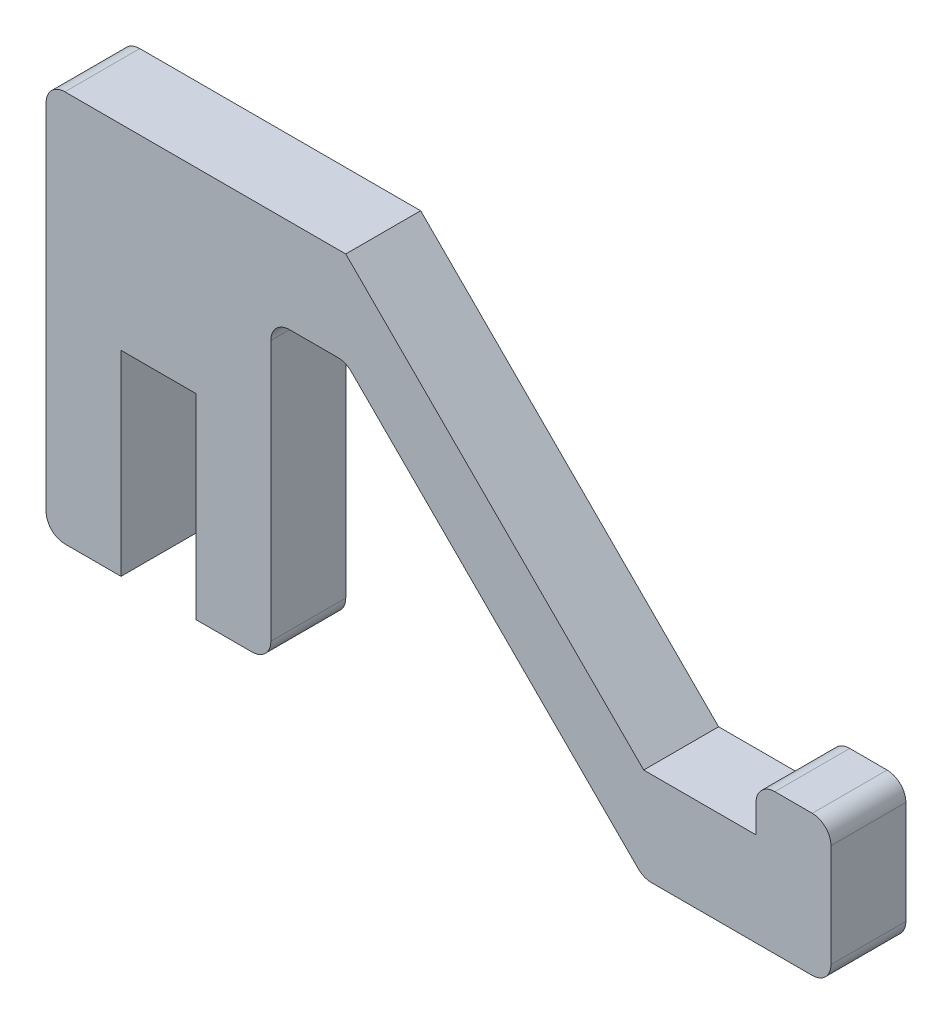
from build123d import *

# Parameters (mm, degrees)
BOSS_EXTRUDE1_DEPTH     = 8
FILLET1_R               = 2
CUT_EXTRUDE1_DEPTH      = 48.514881456
CUT_EXTRUDE1_DEPTH_BACK = 8
SKETCH2_W               = 8
SKETCH2_H               = 20.909902577
CUT_EXTRUDE4_DEPTH      = 1


with BuildPart() as part:
    # Sketch1 → Boss-Extrude1 (new body)
    with BuildSketch(Plane.XY):
        Polygon((-9.909902577, 20.909902577), (21.909902577, -10.909902577), (33.909902577, -10.909902577), (33.909902577, -5.909902577), (41.909902577, -5.909902577), (41.909902577, -20.909902577), (21.909902577, -20.909902577), (-9.909902577, 10.909902577), (-17.909902577, 10.909902577), (-17.909902577, -20.909902577), (-41.909902577, -20.909902577), (-41.909902577, 20.909902577), align=None)
    extrude(amount=BOSS_EXTRUDE1_DEPTH)

    # Fillet1
    fillet1_edges = [part.edges().sort_by_distance(p)[0] for p in [
        (33.909902577, -5.909902577, 4),
        (41.909902577, -5.909902577, 4),
        (41.909902577, -20.909902577, 4),
        (21.909902577, -20.909902577, 4),
        (-9.909902577, 10.909902577, 4),
        (-17.909902577, 10.909902577, 4),
        (-17.909902577, -20.909902577, 4),
        (-41.909902577, -20.909902577, 4),
        (-41.909902577, 20.909902577, 4),
    ]]
    fillet(fillet1_edges, radius=FILLET1_R)

    # Sketch2 → Cut-Extrude1 (cut, two sides: drawn at the far end of the back side and taken through both)
    with BuildSketch(Plane.XY.offset(8).offset(-CUT_EXTRUDE1_DEPTH_BACK)):
        with Locations((-29.909902577, -10.454951289)):
            Rectangle(SKETCH2_W, SKETCH2_H)
    extrude(amount=CUT_EXTRUDE1_DEPTH + CUT_EXTRUDE1_DEPTH_BACK, mode=Mode.SUBTRACT)

    # Sketch4 → Cut-Extrude4 (cut)
    # profile 1 of 8: a face of its own
    with BuildSketch(Plane(origin=(0, 0, 0), x_dir=(-1, 0, 0), z_dir=(0, 0, -1))):
        with BuildLine():
            add(Edge.make_bspline(
                [(-10.505185674, -2.81404301), (-10.472060118, -2.782311922), (-10.406916626, -2.719910738), (-10.300290346, -2.639260568), (-10.190011843, -2.570160554), (-10.075246577, -2.513693897), (-9.95620664, -2.46990326), (-9.833081918, -2.43818906), (-9.705536141, -2.419124274), (-9.575216576, -2.412990965), (-9.445112567, -2.418235002), (-9.317892839, -2.4356685), (-9.195372809, -2.465764732), (-9.07734082, -2.508292597), (-8.963609518, -2.562318787), (-8.855132661, -2.629749473), (-8.750643598, -2.708370751), (-8.686705367, -2.769146111), (-8.654224135, -2.800020574)],
                knots=[0, 0, 0, 0, 1.065182729, 2.094748942, 3.100111911, 4.085511882, 5.061220631, 6.042534805, 7.034972432, 8.052564444, 9.069801487, 10.056734989, 11.031448475, 11.995887646, 12.967539537, 13.951541231, 14.959363372, 16, 16, 16, 16], degree=3))
            add(Edge.make_bspline(
                [(-8.654224135, -2.800020574), (-8.623508066, -2.832156289), (-8.562965851, -2.895496664), (-8.48474761, -2.999485475), (-8.418397281, -3.107860804), (-8.36372245, -3.220827686), (-8.321489765, -3.338684327), (-8.29143091, -3.461382815), (-8.273460431, -3.588710269), (-8.267608823, -3.718999741), (-8.273653126, -3.84921358), (-8.290655566, -3.976509737), (-8.321246019, -4.098836573), (-8.362714813, -4.216853324), (-8.417124869, -4.329952622), (-8.483972036, -4.4378888), (-8.56139579, -4.542158094), (-8.621959448, -4.605358768), (-8.652721731, -4.637460478)],
                knots=[0, 0, 0, 0, 1.042024399, 2.053858669, 3.0450864, 4.018835193, 4.992363513, 5.976262977, 6.976920371, 8.003915854, 9.030911336, 10.031024622, 11.011122082, 11.983334403, 12.960611838, 13.948500462, 14.957975601, 16, 16, 16, 16], degree=3))
            add(Edge.make_bspline(
                [(-8.652721731, -4.637460478), (-8.685371122, -4.668498905), (-8.749644349, -4.729600806), (-8.854612709, -4.808757644), (-8.963399917, -4.87639229), (-9.077270596, -4.931423454), (-9.195483243, -4.97466562), (-9.318572395, -5.005241365), (-9.445894431, -5.023757289), (-9.576177866, -5.030026699), (-9.706285378, -5.024754529), (-9.833141615, -5.007346424), (-9.954908414, -4.977614614), (-10.071934983, -4.936375818), (-10.184131805, -4.883098563), (-10.291046391, -4.817401412), (-10.393737932, -4.740640228), (-10.456345284, -4.681190666), (-10.48815843, -4.650982112)],
                knots=[0, 0, 0, 0, 1.057111361, 2.081017615, 3.080754773, 4.060785583, 5.045399619, 6.03130031, 7.033593295, 8.061879764, 9.089807534, 10.087113287, 11.063523402, 12.028082354, 12.995957114, 13.974128199, 14.970578474, 16, 16, 16, 16], degree=3))
            add(Edge.make_bspline(
                [(-10.48815843, -4.650982112), (-10.508638618, -4.629703527), (-10.549267323, -4.587490955), (-10.604845945, -4.520106817), (-10.655457466, -4.450225024), (-10.702004567, -4.378211753), (-10.742225761, -4.302673727), (-10.778694074, -4.225197344), (-10.809067249, -4.144495009), (-10.835065889, -4.061961215), (-10.855658771, -3.978009545), (-10.870103364, -3.893642664), (-10.879207629, -3.80933979), (-10.882656356, -3.725196044), (-10.880879156, -3.641345185), (-10.872520895, -3.557733122), (-10.859281019, -3.474166441), (-10.83950096, -3.391306761), (-10.815147947, -3.309790698), (-10.785678648, -3.230585908), (-10.750832773, -3.154311079), (-10.711791206, -3.080405577), (-10.667707635, -3.009228071), (-10.618480904, -2.94098444), (-10.564287031, -2.875683043), (-10.524971041, -2.83467825), (-10.505185674, -2.81404301)],
                knots=[0, 0, 0, 0, 1.040069648, 2.063295695, 3.073683405, 4.078545796, 5.081013625, 6.086030863, 7.092973095, 8.11591184, 9.132832499, 10.135369316, 11.128949704, 12.117732983, 13.100060207, 14.080749146, 15.075546923, 16.078290676, 17.079187738, 18.070974109, 19.052597029, 20.031185668, 21.013565695, 21.999319192, 22.993177973, 24, 24, 24, 24], degree=3))
        make_face()
        with BuildLine():
            add(Edge.make_bspline(
                [(-10.325398013, -2.976803426), (-10.341203977, -2.993079954), (-10.372730002, -3.02554455), (-10.414837779, -3.07852864), (-10.454312228, -3.133024481), (-10.48941443, -3.190555489), (-10.521057934, -3.250527905), (-10.548343249, -3.313295344), (-10.57281981, -3.378159539), (-10.592357831, -3.445390945), (-10.608732619, -3.513661805), (-10.619319746, -3.582370879), (-10.6268215, -3.650703593), (-10.62857798, -3.719004533), (-10.626157663, -3.787090844), (-10.619067858, -3.855011043), (-10.607560913, -3.922601939), (-10.591534236, -3.989695413), (-10.571060094, -4.055823126), (-10.545925292, -4.120318641), (-10.516945366, -4.183204428), (-10.483115246, -4.244008391), (-10.445108212, -4.303042071), (-10.402714306, -4.360201092), (-10.356881126, -4.416164311), (-10.322986714, -4.451063158), (-10.305866763, -4.468690446)],
                knots=[0, 0, 0, 0, 0.983693977, 1.962041752, 2.932720314, 3.901532991, 4.883065265, 5.872076546, 6.868879077, 7.888569699, 8.907437036, 9.912309701, 10.902433988, 11.887779398, 12.873364303, 13.856284884, 14.848049896, 15.845772775, 16.846775704, 17.848721296, 18.846680699, 19.848338349, 20.864809226, 21.890321058, 22.934408426, 24, 24, 24, 24], degree=3))
            add(Edge.make_bspline(
                [(-10.305866763, -4.468690446), (-10.279816083, -4.493631301), (-10.228518764, -4.542743223), (-10.144100405, -4.605664691), (-10.056865037, -4.659830432), (-9.965461318, -4.703613071), (-9.870548945, -4.737921342), (-9.77162032, -4.761895158), (-9.669153158, -4.776537798), (-9.564165403, -4.780680704), (-9.459385509, -4.775943196), (-9.357079128, -4.761373519), (-9.258675529, -4.737490192), (-9.164292033, -4.703512225), (-9.073806827, -4.6605568), (-8.987915468, -4.607128678), (-8.904837098, -4.545783914), (-8.8545481, -4.497648208), (-8.829003783, -4.473197657)],
                knots=[0, 0, 0, 0, 1.051851097, 2.071237303, 3.066581889, 4.045146254, 5.023892582, 6.007177031, 7.01121454, 8.040302395, 9.069609416, 10.0688229, 11.052107348, 12.020034829, 12.992099136, 13.969886748, 14.968803156, 16, 16, 16, 16], degree=3))
            add(Edge.make_bspline(
                [(-8.829003783, -4.473197657), (-8.812620956, -4.456011426), (-8.78004309, -4.421835961), (-8.734902501, -4.367868359), (-8.694397771, -4.311335259), (-8.6569051, -4.253379435), (-8.624557077, -4.19254306), (-8.595893949, -4.129849383), (-8.571311931, -4.065100169), (-8.550892347, -3.998491009), (-8.534300149, -3.930994078), (-8.522821415, -3.863017974), (-8.515791094, -3.795273064), (-8.513110632, -3.727505124), (-8.51576682, -3.659899788), (-8.522835721, -3.592493032), (-8.534225858, -3.525161066), (-8.550994697, -3.458376731), (-8.571312312, -3.392181021), (-8.596284899, -3.327758715), (-8.625810289, -3.265245094), (-8.658418776, -3.204141391), (-8.696446697, -3.145292455), (-8.738497935, -3.088326353), (-8.784523435, -3.032995055), (-8.818093456, -2.998297884), (-8.835013398, -2.980809837)],
                knots=[0, 0, 0, 0, 1.026853309, 2.041936333, 3.039952698, 4.033440158, 5.025194378, 6.017158849, 7.013528343, 8.018442471, 9.028918301, 10.017724312, 10.997712279, 11.973141084, 12.948569889, 13.921376208, 14.903065083, 15.899513062, 16.897529427, 17.896485643, 18.884922509, 19.886458766, 20.889919205, 21.912371349, 22.947794663, 24, 24, 24, 24], degree=3))
            add(Edge.make_bspline(
                [(-8.835013398, -2.980809837), (-8.852507093, -2.963899027), (-8.887046376, -2.930510583), (-8.941842255, -2.884696892), (-8.998823506, -2.843886516), (-9.05666159, -2.805590224), (-9.117489028, -2.773678213), (-9.179222679, -2.744548325), (-9.243144749, -2.720693057), (-9.308494904, -2.700603569), (-9.374952125, -2.685199554), (-9.441854058, -2.674046607), (-9.509114404, -2.667604031), (-9.576891209, -2.665360885), (-9.645110783, -2.668814061), (-9.713770855, -2.675417657), (-9.782632251, -2.687777882), (-9.85133138, -2.704240066), (-9.919158616, -2.724523627), (-9.984679179, -2.74909657), (-10.047760948, -2.777313605), (-10.108411133, -2.809291108), (-10.16648304, -2.845502928), (-10.222308527, -2.885132274), (-10.275661049, -2.928676752), (-10.30875796, -2.960702113), (-10.325398013, -2.976803426)],
                knots=[0, 0, 0, 0, 1.05619574, 2.085336687, 3.097259518, 4.098431343, 5.093946709, 6.076502403, 7.06052725, 8.053268447, 9.043068497, 10.020128795, 10.995897894, 11.974784474, 12.961448284, 13.959572234, 14.967646249, 15.996046798, 17.025570501, 18.039282718, 19.032023915, 20.024129928, 21.01366458, 22.001126683, 22.995031332, 24, 24, 24, 24], degree=3))
        make_face(mode=Mode.SUBTRACT)
    # profile 2 of 8: a face of its own
    with BuildSketch(Plane(origin=(0, 0, 0), x_dir=(-1, 0, 0), z_dir=(0, 0, -1))):
        with BuildLine():
            Line((-9.165565083, -1.562563445), (-8.817007391, -1.214005752))
            add(Edge.make_bspline(
                [(-8.817007391, -1.214005752), (-8.793083997, -1.190016361), (-8.747315537, -1.144121637), (-8.679885641, -1.080177602), (-8.61833411, -1.022346833), (-8.562081562, -0.971385734), (-8.510940254, -0.927455128), (-8.464729423, -0.89108378), (-8.424496262, -0.860397826), (-8.398280591, -0.843920327), (-8.386318288, -0.836401586)],
                knots=[0, 0, 0, 0, 1.416971474, 2.710844673, 3.886550687, 4.949426937, 5.885482996, 6.705496379, 7.409313452, 8, 8, 8, 8], degree=3))
            add(Edge.make_bspline(
                [(-8.386318288, -0.836401586), (-8.370751306, -0.827485912), (-8.340012892, -0.809881106), (-8.292109574, -0.787780878), (-8.243533737, -0.769775381), (-8.194375435, -0.755579518), (-8.144430107, -0.745901415), (-8.093621922, -0.741262581), (-8.042072969, -0.739416931), (-7.989964069, -0.742572147), (-7.938147611, -0.749897436), (-7.88711111, -0.762227916), (-7.836862465, -0.778377867), (-7.788313743, -0.800809574), (-7.740976378, -0.827536081), (-7.694689688, -0.858752872), (-7.649400941, -0.894869167), (-7.621049132, -0.922136441), (-7.606570692, -0.936061041)],
                knots=[0, 0, 0, 0, 1.009793068, 1.993927822, 2.966502183, 3.924568233, 4.872155193, 5.826200883, 6.794815104, 7.774044344, 8.761763975, 9.737603538, 10.727467863, 11.728692967, 12.743069578, 13.785922889, 14.869335568, 16, 16, 16, 16], degree=3))
            add(Edge.make_bspline(
                [(-7.606570692, -0.936061041), (-7.592667782, -0.950558788), (-7.565370471, -0.979024017), (-7.528688189, -1.024385565), (-7.496589733, -1.070603408), (-7.46988463, -1.118186223), (-7.447727822, -1.166407226), (-7.430007373, -1.215595136), (-7.417401098, -1.265925455), (-7.410038489, -1.317112872), (-7.406990855, -1.36855277), (-7.408540236, -1.420163962), (-7.414521359, -1.471613148), (-7.425117478, -1.522874293), (-7.440259182, -1.574017209), (-7.460482892, -1.624725391), (-7.484441411, -1.675760307), (-7.503645003, -1.708603313), (-7.513421653, -1.725323861)],
                knots=[0, 0, 0, 0, 1.113350584, 2.185979568, 3.230934622, 4.229778098, 5.207249526, 6.170461489, 7.124557677, 8.078833442, 9.03382718, 9.978356895, 10.938182904, 11.902106184, 12.877339979, 13.8914631, 14.926532666, 16, 16, 16, 16], degree=3))
            add(Edge.make_bspline(
                [(-7.513421653, -1.725323861), (-7.522163254, -1.738583845), (-7.541288793, -1.767595047), (-7.574839886, -1.81305453), (-7.616443999, -1.86344163), (-7.664323958, -1.920349739), (-7.720645993, -1.981976798), (-7.783711962, -2.049784396), (-7.854387029, -2.122699243), (-7.904163154, -2.172923372), (-7.93008832, -2.199081874)],
                knots=[0, 0, 0, 0, 0.603121487, 1.319555111, 2.144347889, 3.084382289, 4.143729233, 5.31447897, 6.601285651, 8, 8, 8, 8], degree=3))
            Line((-7.93008832, -2.199081874), (-8.054787839, -2.323781393))
            Line((-8.054787839, -2.323781393), (-7.240985756, -3.137583477))
            Line((-7.240985756, -3.137583477), (-7.415765403, -3.312363124))
            Line((-7.415765403, -3.312363124), (-9.165565083, -1.562563445))
        make_face()
        with BuildLine():
            Line((-8.820513, -1.558056233), (-8.226061878, -2.152507355))
            Line((-8.226061878, -2.152507355), (-7.92608191, -1.860540208))
            add(Edge.make_bspline(
                [(-7.92608191, -1.860540208), (-7.911598248, -1.845970011), (-7.883701263, -1.817906351), (-7.845428547, -1.775414045), (-7.809808277, -1.736259518), (-7.77953348, -1.697821425), (-7.7521796, -1.662184958), (-7.72981124, -1.627998543), (-7.710768511, -1.596318718), (-7.69167212, -1.556604284), (-7.6744238, -1.50767095), (-7.663026389, -1.448059506), (-7.661601063, -1.38785702), (-7.669683624, -1.327728319), (-7.686833192, -1.269508913), (-7.711459307, -1.213853599), (-7.745280962, -1.162501437), (-7.77323158, -1.132178055), (-7.787359955, -1.116850304)],
                knots=[0, 0, 0, 0, 1.142944814, 2.201426384, 3.181874036, 4.087096959, 4.923094179, 5.680520669, 6.359179662, 6.978196854, 8.129790493, 9.235632842, 10.341358147, 11.465885573, 12.597640581, 13.707727124, 14.84131037, 16, 16, 16, 16], degree=3))
            add(Edge.make_bspline(
                [(-7.787359955, -1.116850304), (-7.802317292, -1.102990126), (-7.831840432, -1.075632586), (-7.882902485, -1.043612124), (-7.937495892, -1.018477743), (-7.995736313, -1.002531069), (-8.05495406, -0.993712435), (-8.113845694, -0.993935848), (-8.171066581, -1.004394056), (-8.217804339, -1.020086446), (-8.254842458, -1.0391515), (-8.285607243, -1.056495191), (-8.317962052, -1.078818701), (-8.352582109, -1.105043987), (-8.389556801, -1.135038574), (-8.428751605, -1.169164217), (-8.46950547, -1.207761842), (-8.497207454, -1.234993607), (-8.511518609, -1.249061842)],
                knots=[0, 0, 0, 0, 1.162901255, 2.295361425, 3.426575654, 4.586107877, 5.732699896, 6.839194033, 7.933783815, 9.043848952, 9.641046512, 10.311860402, 11.060547925, 11.884666868, 12.793370438, 13.780397755, 14.853328635, 16, 16, 16, 16], degree=3))
            Line((-8.511518609, -1.249061842), (-8.820513, -1.558056233))
        make_face(mode=Mode.SUBTRACT)
    # profile 3 of 8: a face of its own
    with BuildSketch(Plane(origin=(0, 0, 0), x_dir=(-1, 0, 0), z_dir=(0, 0, -1))):
        with BuildLine():
            Line((-7.715089634, -0.112087996), (-7.366531942, 0.236469696))
            add(Edge.make_bspline(
                [(-7.366531942, 0.236469696), (-7.342608549, 0.260459088), (-7.296840088, 0.306353811), (-7.229410193, 0.370297846), (-7.167858662, 0.428128615), (-7.111606113, 0.479089714), (-7.060464806, 0.523020321), (-7.014253975, 0.559391669), (-6.974020813, 0.590077622), (-6.947805142, 0.606555122), (-6.935842839, 0.614073863)],
                knots=[0, 0, 0, 0, 1.416971474, 2.710844673, 3.886550687, 4.949426937, 5.885482996, 6.705496379, 7.409313452, 8, 8, 8, 8], degree=3))
            add(Edge.make_bspline(
                [(-6.935842839, 0.614073863), (-6.920275858, 0.622989537), (-6.889537444, 0.640594342), (-6.841634125, 0.662694571), (-6.793058289, 0.680700067), (-6.743899986, 0.69489593), (-6.693954658, 0.704574034), (-6.643146474, 0.709212868), (-6.591597521, 0.711058518), (-6.53948862, 0.707903302), (-6.487672163, 0.700578013), (-6.436635661, 0.688247533), (-6.386387017, 0.672097582), (-6.337838294, 0.649665875), (-6.290500929, 0.622939368), (-6.24421424, 0.591722577), (-6.198925492, 0.555606281), (-6.170573683, 0.528339007), (-6.156095243, 0.514414408)],
                knots=[0, 0, 0, 0, 1.009793068, 1.993927822, 2.966502183, 3.924568233, 4.872155193, 5.826200883, 6.794815104, 7.774044344, 8.761763975, 9.737603538, 10.727467863, 11.728692967, 12.743069578, 13.785922889, 14.869335568, 16, 16, 16, 16], degree=3))
            add(Edge.make_bspline(
                [(-6.156095243, 0.514414408), (-6.142192333, 0.499916661), (-6.114895022, 0.471451432), (-6.078212741, 0.426089884), (-6.046114284, 0.379872041), (-6.019409181, 0.332289226), (-5.997252373, 0.284068222), (-5.979531924, 0.234880312), (-5.96692565, 0.184549993), (-5.959563041, 0.133362577), (-5.956515407, 0.081922679), (-5.958064787, 0.030311486), (-5.96404591, -0.021137699), (-5.974642029, -0.072398844), (-5.989783734, -0.12354176), (-6.010007443, -0.174249942), (-6.033965963, -0.225284858), (-6.053169554, -0.258127864), (-6.062946205, -0.274848413)],
                knots=[0, 0, 0, 0, 1.113350584, 2.185979568, 3.230934622, 4.229778098, 5.207249526, 6.170461489, 7.124557677, 8.078833442, 9.03382718, 9.978356895, 10.938182904, 11.902106184, 12.877339979, 13.8914631, 14.926532666, 16, 16, 16, 16], degree=3))
            add(Edge.make_bspline(
                [(-6.062946205, -0.274848413), (-6.071687805, -0.288108396), (-6.090813345, -0.317119598), (-6.124364437, -0.362579081), (-6.165968551, -0.412966181), (-6.213848509, -0.46987429), (-6.270170544, -0.531501349), (-6.333236513, -0.599308948), (-6.403911581, -0.672223795), (-6.453687705, -0.722447923), (-6.479612871, -0.748606426)],
                knots=[0, 0, 0, 0, 0.603121487, 1.319555111, 2.144347889, 3.084382289, 4.143729233, 5.31447897, 6.601285651, 8, 8, 8, 8], degree=3))
            Line((-6.479612871, -0.748606426), (-6.604312391, -0.873305945))
            Line((-6.604312391, -0.873305945), (-5.790510307, -1.687108028))
            Line((-5.790510307, -1.687108028), (-5.965289955, -1.861887676))
            Line((-5.965289955, -1.861887676), (-7.715089634, -0.112087996))
        make_face()
        with BuildLine():
            Line((-7.370037551, -0.107580785), (-6.775586429, -0.702031906))
            Line((-6.775586429, -0.702031906), (-6.475606461, -0.410064759))
            add(Edge.make_bspline(
                [(-6.475606461, -0.410064759), (-6.4611228, -0.395494563), (-6.433225814, -0.367430903), (-6.394953099, -0.324938596), (-6.359332828, -0.285784069), (-6.329058032, -0.247345976), (-6.301704152, -0.21170951), (-6.279335792, -0.177523094), (-6.260293062, -0.145843269), (-6.241196672, -0.106128835), (-6.223948352, -0.057195501), (-6.212550941, 0.002415942), (-6.211125614, 0.062618429), (-6.219208175, 0.12274713), (-6.236357743, 0.180966535), (-6.260983859, 0.23662185), (-6.294805514, 0.287974012), (-6.322756131, 0.318297394), (-6.336884506, 0.333625145)],
                knots=[0, 0, 0, 0, 1.142944814, 2.201426384, 3.181874036, 4.087096959, 4.923094179, 5.680520669, 6.359179662, 6.978196854, 8.129790493, 9.235632842, 10.341358147, 11.465885573, 12.597640581, 13.707727124, 14.84131037, 16, 16, 16, 16], degree=3))
            add(Edge.make_bspline(
                [(-6.336884506, 0.333625145), (-6.351841844, 0.347485323), (-6.381364983, 0.374842863), (-6.432427037, 0.406863325), (-6.487020443, 0.431997705), (-6.545260864, 0.447944379), (-6.604478611, 0.456763014), (-6.663370246, 0.4565396), (-6.720591133, 0.446081392), (-6.76732889, 0.430389002), (-6.804367009, 0.411323948), (-6.835131794, 0.393980258), (-6.867486603, 0.371656748), (-6.902106661, 0.345431461), (-6.939081352, 0.315436874), (-6.978276157, 0.281311232), (-7.019030021, 0.242713606), (-7.046732005, 0.215481841), (-7.06104316, 0.201413606)],
                knots=[0, 0, 0, 0, 1.162901255, 2.295361425, 3.426575654, 4.586107877, 5.732699896, 6.839194033, 7.933783815, 9.043848952, 9.641046512, 10.311860402, 11.060547925, 11.884666868, 12.793370438, 13.780397755, 14.853328635, 16, 16, 16, 16], degree=3))
            Line((-7.06104316, 0.201413606), (-7.370037551, -0.107580785))
        make_face(mode=Mode.SUBTRACT)
    # profile 4 of 8: a face of its own
    with BuildSketch(Plane(origin=(0, 0, 0), x_dir=(-1, 0, 0), z_dir=(0, 0, -1))):
        with BuildLine():
            add(Edge.make_bspline(
                [(-5.473848961, 2.217293702), (-5.440723406, 2.249024791), (-5.375579914, 2.311425974), (-5.268953634, 2.392076144), (-5.15867513, 2.461176158), (-5.043909865, 2.517642815), (-4.924869927, 2.561433453), (-4.801745206, 2.593147652), (-4.674199429, 2.612212438), (-4.543879863, 2.618345747), (-4.413775854, 2.61310171), (-4.286556126, 2.595668212), (-4.164036097, 2.56557198), (-4.046004108, 2.523044116), (-3.932272806, 2.469017926), (-3.823795949, 2.401587239), (-3.719306885, 2.322965961), (-3.655368655, 2.262190602), (-3.622887423, 2.231316138)],
                knots=[0, 0, 0, 0, 1.065182729, 2.094748942, 3.100111911, 4.085511882, 5.061220631, 6.042534805, 7.034972432, 8.052564444, 9.069801487, 10.056734989, 11.031448475, 11.995887646, 12.967539537, 13.951541231, 14.959363372, 16, 16, 16, 16], degree=3))
            add(Edge.make_bspline(
                [(-3.622887423, 2.231316138), (-3.592171353, 2.199180423), (-3.531629138, 2.135840048), (-3.453410898, 2.031851237), (-3.387060569, 1.923475908), (-3.332385738, 1.810509026), (-3.290153052, 1.692652385), (-3.260094197, 1.569953897), (-3.242123718, 1.442626443), (-3.23627211, 1.312336972), (-3.242316414, 1.182123132), (-3.259318853, 1.054826975), (-3.289909307, 0.932500139), (-3.3313781, 0.814483389), (-3.385788157, 0.701384091), (-3.452635324, 0.593447912), (-3.530059078, 0.489178618), (-3.590622736, 0.425977945), (-3.621385019, 0.393876235)],
                knots=[0, 0, 0, 0, 1.042024399, 2.053858669, 3.0450864, 4.018835193, 4.992363513, 5.976262977, 6.976920371, 8.003915854, 9.030911336, 10.031024622, 11.011122082, 11.983334403, 12.960611838, 13.948500462, 14.957975601, 16, 16, 16, 16], degree=3))
            add(Edge.make_bspline(
                [(-3.621385019, 0.393876235), (-3.65403441, 0.362837807), (-3.718307637, 0.301735906), (-3.823275997, 0.222579068), (-3.932063205, 0.154944422), (-4.045933884, 0.099913258), (-4.164146531, 0.056671092), (-4.287235683, 0.026095347), (-4.414557718, 0.007579423), (-4.544841154, 0.001310013), (-4.674948666, 0.006582183), (-4.801804903, 0.023990288), (-4.923571702, 0.053722098), (-5.040598271, 0.094960894), (-5.152795093, 0.148238149), (-5.259709679, 0.2139353), (-5.362401219, 0.290696485), (-5.425008571, 0.350146046), (-5.456821718, 0.3803546)],
                knots=[0, 0, 0, 0, 1.057111361, 2.081017615, 3.080754773, 4.060785583, 5.045399619, 6.03130031, 7.033593295, 8.061879764, 9.089807534, 10.087113287, 11.063523402, 12.028082354, 12.995957114, 13.974128199, 14.970578474, 16, 16, 16, 16], degree=3))
            add(Edge.make_bspline(
                [(-5.456821718, 0.3803546), (-5.477301905, 0.401633186), (-5.517930611, 0.443845757), (-5.573509233, 0.511229895), (-5.624120754, 0.581111688), (-5.670667855, 0.653124959), (-5.710889048, 0.728662985), (-5.747357362, 0.806139369), (-5.777730537, 0.886841704), (-5.803729177, 0.969375498), (-5.824322059, 1.053327167), (-5.838766652, 1.137694048), (-5.847870916, 1.221996922), (-5.851319643, 1.306140669), (-5.849542443, 1.389991528), (-5.841184183, 1.47360359), (-5.827944306, 1.557170271), (-5.808164248, 1.640029951), (-5.783811235, 1.721546014), (-5.754341936, 1.800750804), (-5.71949606, 1.877025634), (-5.680454494, 1.950931135), (-5.636370923, 2.022108642), (-5.587144191, 2.090352272), (-5.532950319, 2.155653669), (-5.493634329, 2.196658462), (-5.473848961, 2.217293702)],
                knots=[0, 0, 0, 0, 1.040069648, 2.063295695, 3.073683405, 4.078545796, 5.081013625, 6.086030863, 7.092973095, 8.11591184, 9.132832499, 10.135369316, 11.128949704, 12.117732983, 13.100060207, 14.080749146, 15.075546923, 16.078290676, 17.079187738, 18.070974109, 19.052597029, 20.031185668, 21.013565695, 21.999319192, 22.993177973, 24, 24, 24, 24], degree=3))
        make_face()
        with BuildLine():
            add(Edge.make_bspline(
                [(-5.294061301, 2.054533286), (-5.309867265, 2.038256758), (-5.341393289, 2.005792163), (-5.383501066, 1.952808072), (-5.422975516, 1.898312231), (-5.458077718, 1.840781223), (-5.489721221, 1.780808807), (-5.517006537, 1.718041368), (-5.541483097, 1.653177173), (-5.561021118, 1.585945768), (-5.577395907, 1.517674907), (-5.587983034, 1.448965834), (-5.595484787, 1.380633119), (-5.597241268, 1.312332179), (-5.594820951, 1.244245868), (-5.587731146, 1.176325669), (-5.576224201, 1.108734774), (-5.560197524, 1.041641299), (-5.539723382, 0.975513586), (-5.51458858, 0.911018071), (-5.485608654, 0.848132285), (-5.451778534, 0.787328321), (-5.4137715, 0.728294641), (-5.371377594, 0.671135621), (-5.325544414, 0.615172402), (-5.291650002, 0.580273554), (-5.274530051, 0.562646267)],
                knots=[0, 0, 0, 0, 0.983693977, 1.962041752, 2.932720314, 3.901532991, 4.883065265, 5.872076546, 6.868879077, 7.888569699, 8.907437036, 9.912309701, 10.902433988, 11.887779398, 12.873364303, 13.856284884, 14.848049896, 15.845772775, 16.846775704, 17.848721296, 18.846680699, 19.848338349, 20.864809226, 21.890321058, 22.934408426, 24, 24, 24, 24], degree=3))
            add(Edge.make_bspline(
                [(-5.274530051, 0.562646267), (-5.248479371, 0.537705411), (-5.197182052, 0.488593489), (-5.112763693, 0.425672021), (-5.025528324, 0.37150628), (-4.934124605, 0.327723641), (-4.839212232, 0.293415371), (-4.740283607, 0.269441554), (-4.637816445, 0.254798915), (-4.532828691, 0.250656008), (-4.428048797, 0.255393516), (-4.325742416, 0.269963194), (-4.227338817, 0.29384652), (-4.13295532, 0.327824488), (-4.042470115, 0.370779913), (-3.956578756, 0.424208034), (-3.873500386, 0.485552798), (-3.823211387, 0.533688504), (-3.79766707, 0.558139055)],
                knots=[0, 0, 0, 0, 1.051851097, 2.071237303, 3.066581889, 4.045146254, 5.023892582, 6.007177031, 7.01121454, 8.040302395, 9.069609416, 10.0688229, 11.052107348, 12.020034829, 12.992099136, 13.969886748, 14.968803156, 16, 16, 16, 16], degree=3))
            add(Edge.make_bspline(
                [(-3.79766707, 0.558139055), (-3.781284243, 0.575325286), (-3.748706378, 0.609500751), (-3.703565788, 0.663468353), (-3.663061059, 0.720001453), (-3.625568387, 0.777957277), (-3.593220364, 0.838793653), (-3.564557237, 0.90148733), (-3.539975219, 0.966236543), (-3.519555634, 1.032845703), (-3.502963437, 1.100342634), (-3.491484702, 1.168318739), (-3.484454382, 1.236063648), (-3.48177392, 1.303831588), (-3.484430108, 1.371436924), (-3.491499008, 1.438843681), (-3.502889146, 1.506175646), (-3.519657985, 1.572959981), (-3.5399756, 1.639155691), (-3.564948187, 1.703577997), (-3.594473576, 1.766091618), (-3.627082064, 1.827195322), (-3.665109985, 1.886044258), (-3.707161223, 1.94301036), (-3.753186723, 1.998341658), (-3.786756744, 2.033038828), (-3.803676686, 2.050526876)],
                knots=[0, 0, 0, 0, 1.026853309, 2.041936333, 3.039952698, 4.033440158, 5.025194378, 6.017158849, 7.013528343, 8.018442471, 9.028918301, 10.017724312, 10.997712279, 11.973141084, 12.948569889, 13.921376208, 14.903065083, 15.899513062, 16.897529427, 17.896485643, 18.884922509, 19.886458766, 20.889919205, 21.912371349, 22.947794663, 24, 24, 24, 24], degree=3))
            add(Edge.make_bspline(
                [(-3.803676686, 2.050526876), (-3.821170381, 2.067437685), (-3.855709664, 2.100826129), (-3.910505543, 2.146639821), (-3.967486794, 2.187450197), (-4.025324878, 2.225746489), (-4.086152316, 2.257658499), (-4.147885967, 2.286788387), (-4.211808037, 2.310643655), (-4.277158192, 2.330733143), (-4.343615413, 2.346137159), (-4.410517346, 2.357290105), (-4.477777691, 2.363732681), (-4.545554497, 2.365975827), (-4.61377407, 2.362522651), (-4.682434143, 2.355919055), (-4.751295538, 2.343558831), (-4.819994668, 2.327096646), (-4.887821904, 2.306813085), (-4.953342466, 2.282240143), (-5.016424236, 2.254023107), (-5.077074421, 2.222045604), (-5.135146328, 2.185833785), (-5.190971815, 2.146204438), (-5.244324336, 2.102659961), (-5.277421248, 2.070634599), (-5.294061301, 2.054533286)],
                knots=[0, 0, 0, 0, 1.05619574, 2.085336687, 3.097259518, 4.098431343, 5.093946709, 6.076502403, 7.06052725, 8.053268447, 9.043068497, 10.020128795, 10.995897894, 11.974784474, 12.961448284, 13.959572234, 14.967646249, 15.996046798, 17.025570501, 18.039282718, 19.032023915, 20.024129928, 21.01366458, 22.001126683, 22.995031332, 24, 24, 24, 24], degree=3))
        make_face(mode=Mode.SUBTRACT)
    # profile 5 of 8: a face of its own
    with BuildSketch(Plane(origin=(0, 0, 0), x_dir=(-1, 0, 0), z_dir=(0, 0, -1))):
        with BuildLine():
            Line((-2.890237986, 1.865207562), (-2.830642633, 2.103088171))
            add(Edge.make_bspline(
                [(-2.830642633, 2.103088171), (-2.794899116, 2.093267245), (-2.726480964, 2.074468603), (-2.625691355, 2.057532396), (-2.532442992, 2.049638921), (-2.446410153, 2.053443422), (-2.367816348, 2.067628425), (-2.296761476, 2.092883146), (-2.232581963, 2.128390996), (-2.196912724, 2.160614258), (-2.179100165, 2.17670596)],
                knots=[0, 0, 0, 0, 1.291176079, 2.471493815, 3.556724466, 4.546898705, 5.46435486, 6.329279941, 7.165673282, 8, 8, 8, 8], degree=3))
            add(Edge.make_bspline(
                [(-2.179100165, 2.17670596), (-2.164973699, 2.191704337), (-2.137080175, 2.221319499), (-2.10300733, 2.271924598), (-2.07460733, 2.32547377), (-2.053846871, 2.382531619), (-2.039949402, 2.44065753), (-2.032682813, 2.498725605), (-2.035722162, 2.555731038), (-2.045434772, 2.611081169), (-2.063324969, 2.663334295), (-2.086309151, 2.712826696), (-2.11634738, 2.757994536), (-2.140838626, 2.784483112), (-2.153058499, 2.79769955)],
                knots=[0, 0, 0, 0, 1.071286647, 2.115317441, 3.165122386, 4.221206662, 5.266973049, 6.273002152, 7.256239962, 8.228114947, 9.190222097, 10.123424534, 11.06368533, 12, 12, 12, 12], degree=3))
            add(Edge.make_bspline(
                [(-2.153058499, 2.79769955), (-2.16827907, 2.811684428), (-2.199085942, 2.839990223), (-2.2549432, 2.871371009), (-2.316715109, 2.896861784), (-2.361341643, 2.90610089), (-2.384428691, 2.910880639)],
                knots=[0, 0, 0, 0, 0.945448006, 1.913613914, 2.920631048, 4, 4, 4, 4], degree=3))
            add(Edge.make_bspline(
                [(-2.384428691, 2.910880639), (-2.40193336, 2.913423031), (-2.438664488, 2.91875789), (-2.49704447, 2.922891655), (-2.561029628, 2.924962577), (-2.63087585, 2.92380801), (-2.706344019, 2.91955974), (-2.787528702, 2.913165089), (-2.874322547, 2.903425853), (-2.933989093, 2.895466918), (-2.964857377, 2.891349389)],
                knots=[0, 0, 0, 0, 0.728237508, 1.528105792, 2.408504073, 3.364194011, 4.403737984, 5.52102854, 6.71751255, 8, 8, 8, 8], degree=3))
            add(Edge.make_bspline(
                [(-2.964857377, 2.891349389), (-2.995565255, 2.887281915), (-3.054271572, 2.879505851), (-3.138378833, 2.869339553), (-3.214346107, 2.86174256), (-3.282317582, 2.856715263), (-3.34226709, 2.853622728), (-3.394202715, 2.852421302), (-3.438245468, 2.853413801), (-3.46467287, 2.856771449), (-3.476676287, 2.858296505)],
                knots=[0, 0, 0, 0, 1.446122065, 2.764648949, 3.95499131, 5.00997518, 5.946344691, 6.75700229, 7.435426173, 8, 8, 8, 8], degree=3))
            add(Edge.make_bspline(
                [(-3.476676287, 2.858296505), (-3.49442827, 2.86118633), (-3.52937234, 2.866874835), (-3.580223391, 2.880173945), (-3.628845462, 2.8965531), (-3.675069975, 2.916674473), (-3.71909882, 2.940274426), (-3.760422171, 2.968122548), (-3.800407277, 2.998369236), (-3.824609618, 3.021480684), (-3.836752409, 3.033076152)],
                knots=[0, 0, 0, 0, 1.058992889, 2.084585255, 3.092151245, 4.078670416, 5.051071046, 6.030210775, 7.011717962, 8, 8, 8, 8], degree=3))
            add(Edge.make_bspline(
                [(-3.836752409, 3.033076152), (-3.854903907, 3.052269827), (-3.890617105, 3.090033515), (-3.933020989, 3.154999576), (-3.967785998, 3.223065797), (-3.991413836, 3.295628409), (-4.006478371, 3.370099083), (-4.009585845, 3.446179556), (-4.003222986, 3.522659444), (-3.985914268, 3.598874811), (-3.959097967, 3.673139637), (-3.922696393, 3.743480877), (-3.878019785, 3.809813112), (-3.841337407, 3.848691376), (-3.822729973, 3.868412691)],
                knots=[0, 0, 0, 0, 1.018756783, 2.00441099, 2.985114787, 3.964120394, 4.943168492, 5.911686244, 6.895629666, 7.900220798, 8.922401846, 9.937784271, 10.953924345, 12, 12, 12, 12], degree=3))
            add(Edge.make_bspline(
                [(-3.822729973, 3.868412691), (-3.801727902, 3.888098273), (-3.760052307, 3.927161486), (-3.688415241, 3.973945254), (-3.612059179, 4.012065659), (-3.543789975, 4.03575654), (-3.485311692, 4.048860708), (-3.437494911, 4.056502898), (-3.385938783, 4.060657894), (-3.330959438, 4.062785094), (-3.272454831, 4.06162175), (-3.210303755, 4.057533683), (-3.144505955, 4.050473547), (-3.099554097, 4.044002099), (-3.076536063, 4.040688332)],
                knots=[0, 0, 0, 0, 1.295389454, 2.570514484, 3.839162407, 5.136037099, 5.815087671, 6.538780224, 7.316766775, 8.145019492, 9.018002452, 9.952992277, 10.951809883, 12, 12, 12, 12], degree=3))
            Line((-3.076536063, 4.040688332), (-3.111091351, 3.789786889))
            add(Edge.make_bspline(
                [(-3.111091351, 3.789786889), (-3.129614388, 3.792166254), (-3.165287337, 3.796748599), (-3.2169917, 3.802695932), (-3.265143673, 3.805356558), (-3.309731388, 3.807226764), (-3.350658388, 3.806499589), (-3.388004291, 3.804990397), (-3.421428185, 3.800312674), (-3.460750812, 3.7924782), (-3.506005308, 3.778053582), (-3.556540562, 3.753774967), (-3.603636734, 3.722603409), (-3.631413974, 3.697034548), (-3.645446319, 3.684117819)],
                knots=[0, 0, 0, 0, 1.184218173, 2.280649553, 3.298770581, 4.241350513, 5.109366531, 5.893783283, 6.609332804, 7.246620599, 8.434994267, 9.609093371, 10.792175694, 12, 12, 12, 12], degree=3))
            add(Edge.make_bspline(
                [(-3.645446319, 3.684117819), (-3.661717619, 3.666495842), (-3.693201382, 3.63239862), (-3.727051514, 3.572988448), (-3.748866111, 3.510901124), (-3.75679673, 3.446696411), (-3.751675226, 3.383593576), (-3.735157849, 3.323584627), (-3.705509197, 3.268104043), (-3.677375232, 3.23686625), (-3.662974364, 3.220876633)],
                knots=[0, 0, 0, 0, 1.108181413, 2.144249075, 3.142172967, 4.13985706, 5.117432795, 6.057641393, 7.00576941, 8, 8, 8, 8], degree=3))
            add(Edge.make_bspline(
                [(-3.662974364, 3.220876633), (-3.653163986, 3.211618193), (-3.633774811, 3.193319868), (-3.60095963, 3.170078999), (-3.566057477, 3.150158267), (-3.528134938, 3.133103549), (-3.485686162, 3.119816183), (-3.437556164, 3.111378601), (-3.38349243, 3.105754555), (-3.345482907, 3.105058093), (-3.3254343, 3.104690736)],
                knots=[0, 0, 0, 0, 0.880441848, 1.740100151, 2.619460374, 3.503206461, 4.451875234, 5.517205648, 6.690418517, 8, 8, 8, 8], degree=3))
            add(Edge.make_bspline(
                [(-3.3254343, 3.104690736), (-3.318419778, 3.104972761), (-3.301527394, 3.105651934), (-3.272152593, 3.108410836), (-3.234388012, 3.112299771), (-3.188564089, 3.118675003), (-3.134268095, 3.125513097), (-3.071791436, 3.133915091), (-3.001113127, 3.144800052), (-2.951175619, 3.151979508), (-2.924793274, 3.155772466)],
                knots=[0, 0, 0, 0, 0.416963678, 1.004132585, 1.752086881, 2.672130089, 3.75206962, 5.003039264, 6.416684121, 8, 8, 8, 8], degree=3))
            add(Edge.make_bspline(
                [(-2.924793274, 3.155772466), (-2.892761486, 3.160257954), (-2.830788376, 3.168936197), (-2.740475197, 3.179170467), (-2.655773817, 3.185584618), (-2.576613475, 3.189360713), (-2.502902652, 3.189511416), (-2.434888999, 3.185963999), (-2.372438215, 3.17982157), (-2.29807916, 3.16650625), (-2.213074959, 3.143159436), (-2.12018123, 3.103823022), (-2.037072984, 3.054054017), (-1.990339278, 3.011514783), (-1.967261223, 2.990508043)],
                knots=[0, 0, 0, 0, 1.154073635, 2.232829841, 3.242441131, 4.184480987, 5.060076888, 5.871224333, 6.613870166, 7.297408356, 8.56479994, 9.749711327, 10.888761692, 12, 12, 12, 12], degree=3))
            add(Edge.make_bspline(
                [(-1.967261223, 2.990508043), (-1.952064283, 2.974444929), (-1.922012444, 2.942680236), (-1.88327612, 2.890306011), (-1.851370258, 2.834759437), (-1.82410177, 2.77690906), (-1.804626852, 2.715477445), (-1.789552216, 2.651428047), (-1.781951908, 2.584229486), (-1.780005758, 2.515045632), (-1.783769758, 2.445621297), (-1.79424893, 2.377649839), (-1.811473807, 2.312304949), (-1.834459989, 2.249263936), (-1.864371176, 2.188777224), (-1.900442252, 2.130773562), (-1.942819332, 2.075022599), (-1.975271021, 2.040861123), (-1.991800486, 2.023460768)],
                knots=[0, 0, 0, 0, 0.987419472, 1.952614886, 2.901856038, 3.846337881, 4.803981627, 5.775639995, 6.782227406, 7.819438665, 8.865383083, 9.88443968, 10.886706716, 11.880192648, 12.877590837, 13.895937461, 14.928283006, 16, 16, 16, 16], degree=3))
            add(Edge.make_bspline(
                [(-1.991800486, 2.023460768), (-2.005134023, 2.010565021), (-2.031610052, 1.984958301), (-2.074426011, 1.950442465), (-2.118768787, 1.919471589), (-2.165002026, 1.892085508), (-2.21264151, 1.868183749), (-2.262218362, 1.847975212), (-2.313452233, 1.831453244), (-2.366631796, 1.818358961), (-2.422196711, 1.809156396), (-2.480504366, 1.804923874), (-2.541557653, 1.804490975), (-2.605638606, 1.80798667), (-2.672644081, 1.816255505), (-2.742657015, 1.828321165), (-2.815748633, 1.844318774), (-2.864928947, 1.858110237), (-2.890237986, 1.865207562)],
                knots=[0, 0, 0, 0, 0.923538325, 1.833844056, 2.735718552, 3.615553036, 4.507987595, 5.388097057, 6.279485181, 7.186976507, 8.113765487, 9.08117723, 10.095613012, 11.153191372, 12.275284651, 13.456332994, 14.690985064, 16, 16, 16, 16], degree=3))
        make_face()
    # profile 6 of 8: a face of its own
    with BuildSketch(Plane(origin=(0, 0, 0), x_dir=(-1, 0, 0), z_dir=(0, 0, -1))):
        Polygon((-2.934428172, 4.668573466), (-2.759648525, 4.843353113), (-1.009848845, 3.093553434), (-1.184628493, 2.918773786), align=None)
    # profile 7 of 8: a face of its own
    with BuildSketch(Plane(origin=(0, 0, 0), x_dir=(-1, 0, 0), z_dir=(0, 0, -1))):
        Polygon((-2.368965424, 4.893491342), (-2.53923786, 5.063763778), (-1.579201802, 6.023799836), (-1.408929366, 5.8535274), (-1.799053565, 5.463403201), (-0.219526321, 3.883875958), (-0.397811578, 3.705590701), (-1.977338821, 5.285117945), align=None)
    # profile 8 of 8: a face of its own
    with BuildSketch(Plane(origin=(0, 0, 0), x_dir=(-1, 0, 0), z_dir=(0, 0, -1))):
        Polygon((-1.321428183, 6.281573456), (-0.318824016, 7.284177622), (-0.146047574, 7.11140118), (-0.973872093, 6.283576661), (-0.426997093, 5.736701661), (0.393315407, 6.557014161), (0.564589446, 6.385740122), (-0.255723054, 5.565427622), (0.430875503, 4.878829065), (1.251188003, 5.699141565), (1.423463644, 5.526865924), (0.428371497, 4.531773776), align=None)
    extrude(amount=-CUT_EXTRUDE4_DEPTH, mode=Mode.SUBTRACT)


solid = part.part
